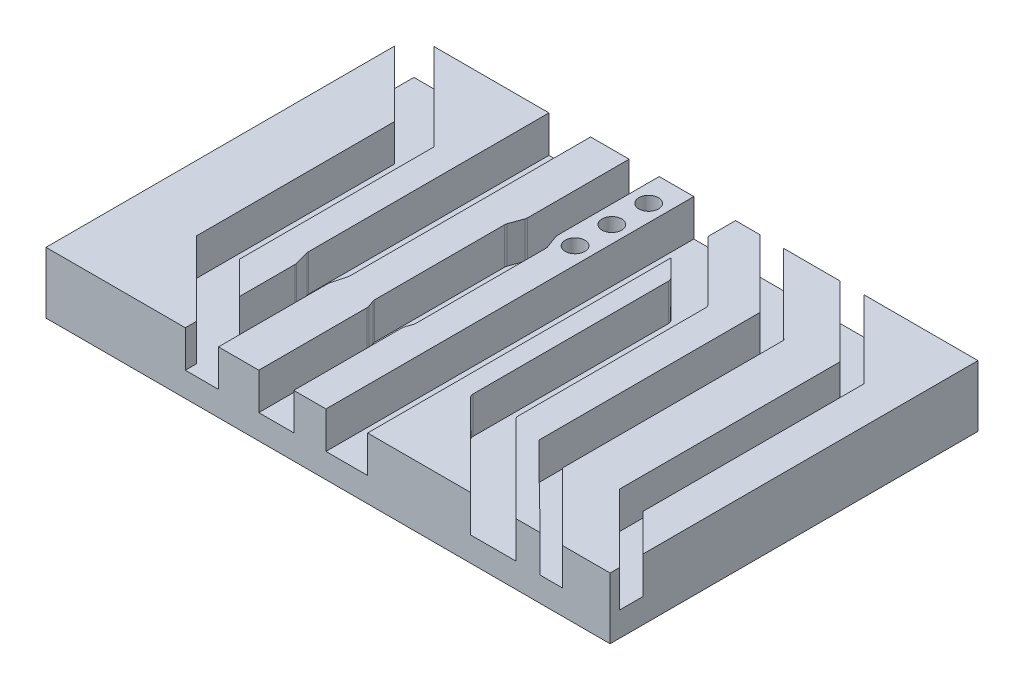
from build123d import *

# Parameters (mm, degrees)
SKETCH1_W           = 292.1
SKETCH1_H           = 190.5
BOSS_EXTRUDE1_DEPTH = 31.75
CUT_EXTRUDE1_DEPTH  = 19.05
FILLET1_R           = 3.175
SKETCH8_R           = 5.08
CUT_EXTRUDE2_DEPTH  = 12.7
CUT_EXTRUDE3_DEPTH  = 19.05
CUT_EXTRUDE4_START  = -19.05
CUT_EXTRUDE4_DEPTH  = 19.05


with BuildPart() as part:
    # Sketch1 → Boss-Extrude1 (new body)
    with BuildSketch(Plane(origin=(0, 0, 0), x_dir=(1, 0, 0), z_dir=(0, 1, 0))):
        Rectangle(SKETCH1_W, SKETCH1_H)
    extrude(amount=BOSS_EXTRUDE1_DEPTH)

    # Sketch5 → Cut-Extrude1 (cut)
    with BuildSketch(Plane(origin=(0, 31.75, 0), x_dir=(1, 0, 0), z_dir=(0, 1, 0))):
        Polygon((-54.537973011, 56.645897063), (-54.537973011, 45.282587268), (-54.537973011, -9.143020761), (-54.537973011, -29.727810076), (-56.751368127, -37.988313106), (-56.751368127, -113.256317169), (-73.902361837, -113.256317169), (-73.902361837, -37.988313106), (-76.115756953, -29.727810076), (-76.115756953, -11.930912732), (-76.115756953, -9.143020761), (-76.115756953, 45.282587268), (-76.115756953, 56.645897063), (-76.115756953, 64.900897063), (-76.115756953, 123.938542293), (-54.537973011, 123.938542293), (-54.537973011, 64.900897063), align=None)
        Polygon((-35.869641097, -54.76875), (-35.869641097, -113.256317169), (-17.739641097, -113.256317169), (-17.739641097, -54.76875), (-17.739641097, -38.54651566), (-16.168929869, -34.231022029), (-16.168929869, 34.231022029), (-19.014641097, 42.04954937), (-19.014641097, 54.76875), (-19.014641097, 123.938542293), (-34.594641097, 123.938542293), (-34.594641097, 54.76875), (-34.594641097, 42.04954937), (-37.440352325, 34.231022029), (-37.440352325, -34.231022029), (-35.869641097, -38.54651566), align=None)
        Polygon((68.007088005, -12.827), (68.007088005, -53.93599914), (75.733185186, -61.662096321), (85.826970956, -71.755882091), (120.911645373, -106.060842413), (128.794129656, -102.532519884), (91.922231409, -65.660621637), (86.625610633, -60.36400086), (86.625610633, -12.827), (86.625610633, 12.827), (86.625610633, 54.107702226), (78.899513451, 61.662096321), (69.164333129, 71.397276643), (30.279619459, 110.281990313), (23.687738087, 104.683350778), (63.069072676, 65.302016189), (68.007088005, 60.36400086), (68.007088005, 12.827), align=None)
        Polygon((20.489996677, 80.981024842), (20.489996677, 107.787781329), (-1.087787265, 107.787781329), (-1.087787265, 37.36975), (-1.087787265, -17.055858029), (-1.087787265, -113.256317169), (20.489996677, -113.256317169), (20.489996677, -17.055858029), (20.489996677, 37.36975), (20.489996677, 61.776004665), (30.279619459, 51.986381883), (30.279619459, -51.734938461), (111.842171541, -133.297490543), (131.611931441, -129.619589579), (51.857403402, -49.865061539), (51.857403402, 49.613618117), align=None)
    extrude(amount=-CUT_EXTRUDE1_DEPTH, mode=Mode.SUBTRACT)

    # Fillet1
    fillet1_edges = [part.edges().sort_by_distance(p)[0] for p in [
        (-34.594641097, 22.225, -42.04954937),
        (-17.739641097, 22.225, 38.54651566),
        (-37.440352325, 22.225, 34.231022029),
        (-37.440352325, 22.225, -34.231022029),
        (-19.014641097, 22.225, -42.04954937),
        (-16.168929869, 22.225, -34.231022029),
        (-16.168929869, 22.225, 34.231022029),
        (-35.869641097, 22.225, 38.54651566),
        (51.857403402, 22.225, 49.865061539),
        (51.857403402, 22.225, -49.613618117),
        (30.279619459, 22.225, 51.734938461),
        (30.279619459, 22.225, -51.986381883),
        (-76.115756953, 22.225, 29.727810076),
        (-56.751368127, 22.225, 37.988313106),
        (-73.902361837, 22.225, 37.988313106),
        (-54.537973011, 22.225, 29.727810076),
    ]]
    fillet(fillet1_edges, radius=FILLET1_R)

    # Sketch8 → Cut-Extrude2 (cut)
    with BuildSketch(Plane(origin=(0, 31.75, 0), x_dir=(1, 0, 0), z_dir=(0, 1, 0))):
        with Locations(Location((-9.751260883, 42.41224903, 0), (0, 0, 270))):
            Circle(SKETCH8_R)
        with Locations(Location((-9.751260883, 61.46224903, 0), (0, 0, 270))):
            Circle(SKETCH8_R)
        with Locations(Location((-9.751260883, 80.51224903, 0), (0, 0, 270))):
            Circle(SKETCH8_R)
    extrude(amount=-CUT_EXTRUDE2_DEPTH, mode=Mode.SUBTRACT)

    # Sketch10 → Cut-Extrude3 (cut)
    with BuildSketch(Plane(origin=(0, 31.75, 0), x_dir=(1, 0, 0), z_dir=(0, 1, 0))):
        Polygon((110.861963616, 12.827), (110.861963616, -12.827), (110.861963616, -55.20599914), (117.318060797, -61.662096321), (127.591928077, -71.935963601), (167.375411749, -111.719447273), (167.375411749, -99.528926365), (133.687188531, -65.840703147), (126.940486244, -59.09400086), (126.940486244, -12.827), (126.940486244, 12.827), (126.940486244, 55.20599914), (120.484389062, 61.662096321), (110.927960718, 71.218524666), (71.315632765, 110.830852619), (59.125111857, 110.830852619), (104.832700264, 65.123264212), (110.861963616, 59.09400086), align=None)
    extrude(amount=-CUT_EXTRUDE3_DEPTH, mode=Mode.SUBTRACT)

    # Sketch13 → Cut-Extrude4 (cut)
    with BuildSketch(Plane(origin=(0, 31.75, 0), x_dir=(1, 0, 0), z_dir=(0, 1, 0)).offset(CUT_EXTRUDE4_START)):
        Polygon((-90.636160304, -19.2405), (-90.636160304, 19.2405), (-90.636160304, 50.320724899), (-99.345622638, 59.030187232), (-118.720884143, 78.405448738), (-162.613070171, 122.297634766), (-162.613070171, 101.678401026), (-129.030501013, 68.095831868), (-112.213944246, 51.279275101), (-112.213944246, 19.2405), (-112.213944246, -19.2405), (-112.213944246, -51.02783168), (-103.858035303, -59.383740623), (-84.482773798, -78.759002128), (-70.58319311, -92.658582816), (-70.58319311, -70.625135514), (-73.466050147, -67.742278477), (-90.636160304, -50.57216832), align=None)
    extrude(amount=CUT_EXTRUDE4_DEPTH, mode=Mode.SUBTRACT)


solid = part.part
